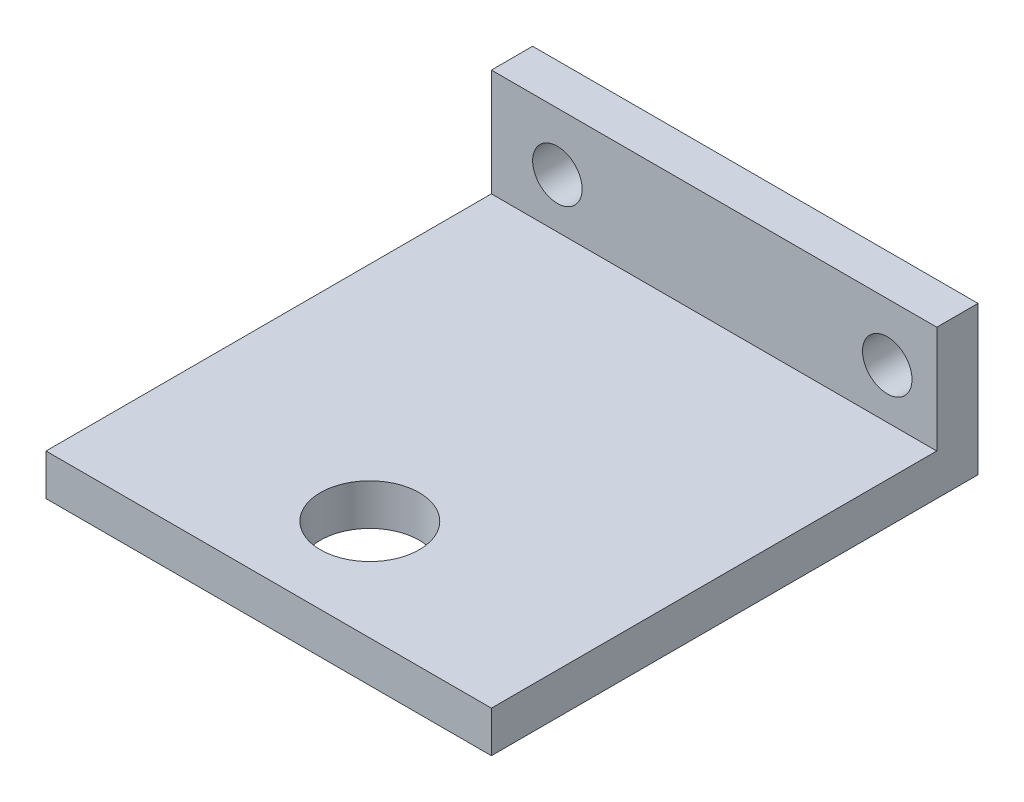
from build123d import *

# Parameters (mm, degrees)
ESQUISSE1_W             = 54
ESQUISSE1_H             = 18
ESQUISSE1_R             = 3
BOSS_EXTRU_1_DEPTH      = 59
ESQUISSE2_W             = 89.885876072
ESQUISSE2_H             = 74.564815434
ENL_V_MAT_EXTRU_1_DEPTH = 13
ESQUISSE3_R             = 6
ENL_V_MAT_EXTRU_2_DEPTH = 13


with BuildPart() as part:
    # Esquisse1 → Boss.-Extru.1 (new body)
    with BuildSketch(Plane.XY):
        Rectangle(ESQUISSE1_W, ESQUISSE1_H)
        with Locations((-19, 2)):
            Circle(ESQUISSE1_R, mode=Mode.SUBTRACT)
        with Locations((21, 2)):
            Circle(ESQUISSE1_R, mode=Mode.SUBTRACT)
    extrude(amount=BOSS_EXTRU_1_DEPTH)

    # Esquisse2 → Enlèv. mat.-Extru.1 (cut)
    with BuildSketch(Plane(origin=(0, 9, 0), x_dir=(1, 0, 0), z_dir=(0, 1, 0))):
        with Locations((-2.437014962, -42.282407717)):
            Rectangle(ESQUISSE2_W, ESQUISSE2_H)
    extrude(amount=-ENL_V_MAT_EXTRU_1_DEPTH, mode=Mode.SUBTRACT)

    # Esquisse3 → Enlèv. mat.-Extru.2 (cut)
    with BuildSketch(Plane(origin=(0, -4, 0), x_dir=(1, 0, 0), z_dir=(0, 1, 0))):
        with Locations(Location((0, -46.74, 0), (0, 0, 270))):
            Circle(ESQUISSE3_R)
    extrude(amount=-ENL_V_MAT_EXTRU_2_DEPTH, mode=Mode.SUBTRACT)


solid = part.part
